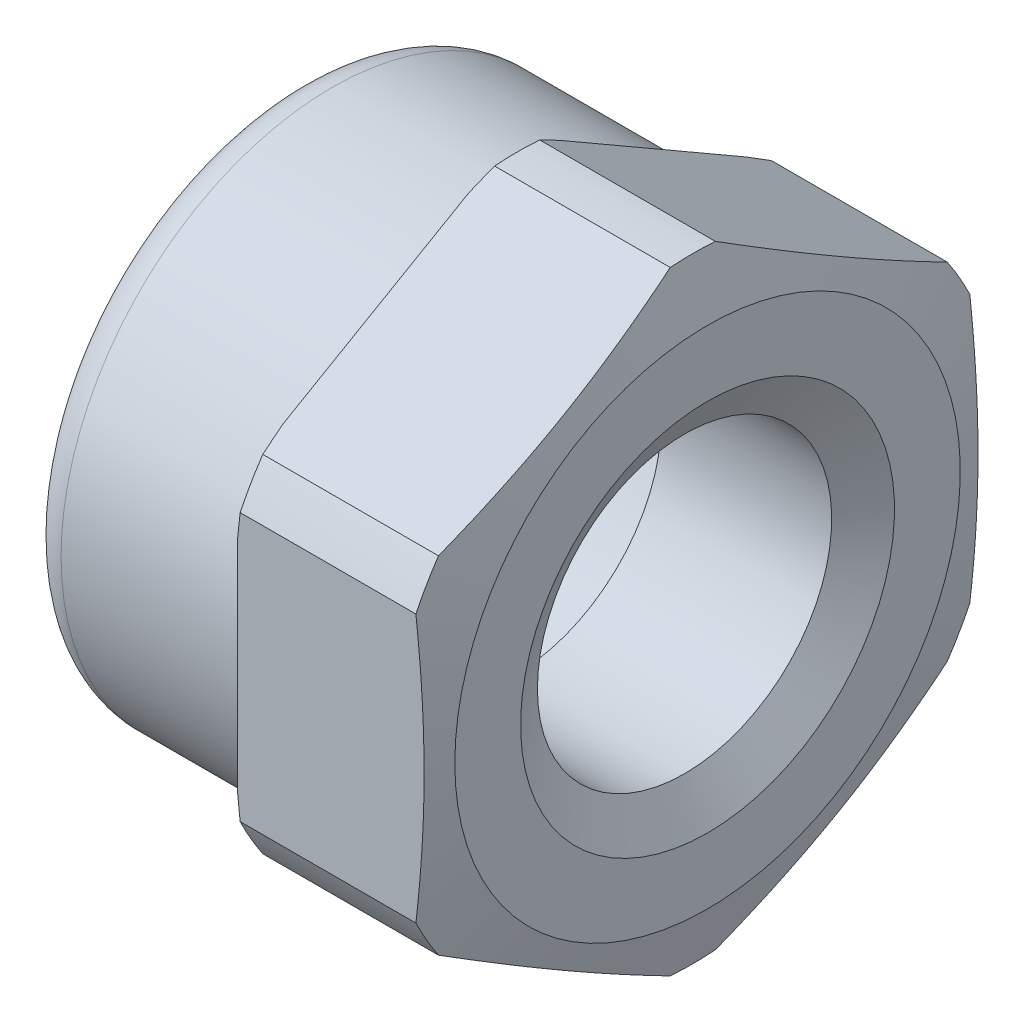
from build123d import *

# Parameters (mm, degrees)
SKETCH_2_OUTSIDE_W  = 25.332
SKETCH_2_OUTSIDE_H  = 25.332
CUT_EXTRUDE_1_DEPTH = 18.305965734


with BuildPart() as part:
    # Эскиз1 → Повернуть1 (revolve)
    with BuildSketch(Plane.XY, mode=Mode.PRIVATE) as revolve_1_sk:
        with BuildLine():
            Line((-11.9, 6.773556454), (-11.9, 5))
            Line((-11.9, 5), (-10.847112909, 5))
            Line((-10.847112909, 5), (-10.847112909, 6.773556454))
            Line((-10.847112909, 6.773556454), (-5.582677453, 6.773556454))
            Line((-5.582677453, 6.773556454), (-5.582677453, 4.25))
            Line((-5.582677453, 4.25), (0, 4.25))
            Line((0, 4.25), (0, 7.3))
            Line((0, 7.3), (-0.42469947, 8.885))
            Line((-0.42469947, 8.885), (-5.5, 8.885))
            Line((-5.5, 8.885), (-5.582677453, 8.576443546))
            Line((-5.582677453, 8.576443546), (-5.582677453, 7.826443546))
            Line((-5.582677453, 7.826443546), (-10.847112909, 7.826443546))
            ThreePointArc((-10.847112909, 7.826443546), (-11.591616511, 7.518060056), (-11.9, 6.773556454))
        make_face()
    revolve(revolve_1_sk.sketch.rotate(Axis((-1000, 0, 0), (1, 0, 0)), 90), axis=Axis((-1000, 0, 0), (1, 0, 0)))

    # Эскиз2 outside → Вырез-Вытянуть1 (cut, through all)
    with BuildSketch(Plane(origin=(0, 0, 0), x_dir=(0, 0, -1), z_dir=(1, 0, 0))):
        Rectangle(SKETCH_2_OUTSIDE_W, SKETCH_2_OUTSIDE_H)
        Polygon((8, -4.618802154), (8, 4.618802154), (0, 9.237604307), (-8, 4.618802154), (-8, -4.618802154), (0, -9.237604307), align=None, mode=Mode.SUBTRACT)
    extrude(amount=-CUT_EXTRUDE_1_DEPTH, mode=Mode.SUBTRACT)

    # Эскиз3 → Вырез-Повернуть1 (revolve, cut)
    with BuildSketch(Plane.XY, mode=Mode.PRIVATE) as cut_revolve_1_sk:
        Polygon((0, 0), (0, 5.4), (-0.66395281, 4.25), (-0.66395281, 0), align=None)
    revolve(cut_revolve_1_sk.sketch.rotate(Axis((-0.66395281, 0, 0), (1.0, -1.853694946210833e-11, 0)), 90.000000001), axis=Axis((-0.66395281, 0, 0), (1.0, -1.853694946210833e-11, 0)), mode=Mode.SUBTRACT)


solid = part.part
